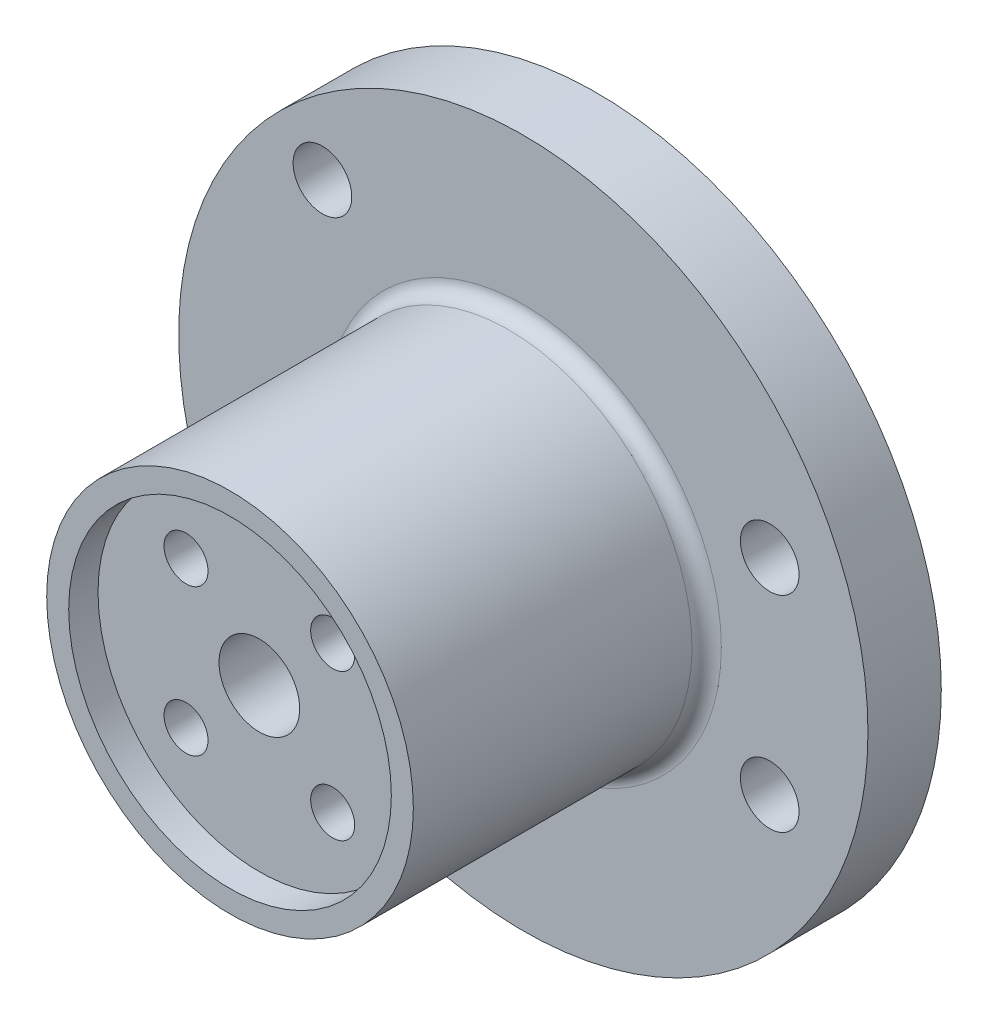
from build123d import *

# Parameters (mm, degrees)
SKETCH_1_R          = 23.5
EXTRUDE_1_DEPTH     = 5
SKETCH_2_R          = 2
CUT_EXTRUDE_1_DEPTH = 59.495923488
SKETCH_3_R          = 12.5
EXTRUDE_3_DEPTH     = 25
SKETCH_4_R          = 4
SKETCH_4_R_2        = 1.5
CUT_EXTRUDE_2_DEPTH = 64.41745079
SKETCH_5_R          = 11
CUT_EXTRUDE_3_DEPTH = 2
CUT_EXTRUDE_START   = -20
SKETCH_6_R          = 2.75
SKETCH_6_R_2        = 1.5
CUT_EXTRUDE_5_DEPTH = 20
EXTRUDE_START       = -23
SKETCH_7_R          = 4
SKETCH_7_R_2        = 2.75
EXTRUDE_4_DEPTH     = 23
FILLET_1_R          = 1


with BuildPart() as part:
    # 草图1 → 凸台-拉伸1 (new body)
    with BuildSketch(Plane.XY):
        with Locations((0, -29.834070393)):
            Circle(SKETCH_1_R)
    extrude(amount=EXTRUDE_1_DEPTH)

    # 草图2 → 切除-拉伸1 (cut, through all)
    with BuildSketch(Plane(origin=(0, 0, 0), x_dir=(-1, 0, 0), z_dir=(0, 0, -1))):
        with Locations((13.699273048, -15.834070393)):
            Circle(SKETCH_2_R)
        with Locations((13.699273048, -43.834070393)):
            Circle(SKETCH_2_R)
        with Locations((-16.800726952, -22.884070393)):
            Circle(SKETCH_2_R)
        with Locations((-16.800726952, -36.884070393)):
            Circle(SKETCH_2_R)
        with Locations((13.699273048, -29.834070393)):
            Circle(SKETCH_2_R)
    extrude(amount=-CUT_EXTRUDE_1_DEPTH, mode=Mode.SUBTRACT)

    # 草图3 → 凸台-拉伸3 (add)
    with BuildSketch(Plane(origin=(0, 0, 0), x_dir=(-1, 0, 0), z_dir=(0, 0, -1))):
        with Locations((0, -29.834070393)):
            Circle(SKETCH_3_R)
    extrude(amount=-EXTRUDE_3_DEPTH)

    # 草图4 → 切除-拉伸2 (cut, through all)
    with BuildSketch(Plane.XY.offset(25)):
        with BuildLine():
            ThreePointArc((-3.5, -24.834070393), (-6.060660172, -23.773410221), (-5, -26.334070393))
            Line((-5, -26.334070393), (-5, -24.834070393))
            Line((-5, -24.834070393), (-3.5, -24.834070393))
        make_face()
        with BuildLine():
            Line((-5, -24.834070393), (-5, -26.334070393))
            ThreePointArc((-5, -26.334070393), (-3.939339828, -25.894730565), (-3.5, -24.834070393))
            Line((-3.5, -24.834070393), (-5, -24.834070393))
        make_face()
        with BuildLine():
            ThreePointArc((3.5, -24.834070393), (3.939339828, -25.894730565), (5, -26.334070393))
            Line((5, -26.334070393), (5, -24.834070393))
            Line((5, -24.834070393), (3.5, -24.834070393))
        make_face()
        with BuildLine():
            Line((5, -24.834070393), (5, -26.334070393))
            ThreePointArc((5, -26.334070393), (6.060660172, -25.894730565), (6.5, -24.834070393))
            ThreePointArc((6.5, -24.834070393), (5, -23.334070393), (3.5, -24.834070393))
            Line((3.5, -24.834070393), (5, -24.834070393))
        make_face()
        with BuildLine():
            ThreePointArc((5, -33.334070393), (3.939339828, -33.773410221), (3.5, -34.834070393))
            Line((3.5, -34.834070393), (5, -34.834070393))
            Line((5, -34.834070393), (5, -33.334070393))
        make_face()
        with BuildLine():
            Line((5, -34.834070393), (3.5, -34.834070393))
            ThreePointArc((3.5, -34.834070393), (5, -36.334070393), (6.5, -34.834070393))
            ThreePointArc((6.5, -34.834070393), (6.060660172, -33.773410221), (5, -33.334070393))
            Line((5, -33.334070393), (5, -34.834070393))
        make_face()
        with Locations((0, -29.834070393)):
            Circle(SKETCH_4_R)
        with Locations((-5, -34.834070393)):
            Circle(SKETCH_4_R_2)
    extrude(amount=-CUT_EXTRUDE_2_DEPTH, mode=Mode.SUBTRACT)

    # 草图5 → 切除-拉伸3 (cut)
    with BuildSketch(Plane.XY.offset(25)):
        with Locations((0, -29.834070393)):
            Circle(SKETCH_5_R)
    extrude(amount=-CUT_EXTRUDE_3_DEPTH, mode=Mode.SUBTRACT)

    # 草图6 → 切除-拉伸5 (cut)
    # profile 1 of 4: a face of its own
    with BuildSketch(Plane(origin=(0, 0, 0), x_dir=(-1, 0, 0), z_dir=(0, 0, -1)).offset(CUT_EXTRUDE_START)):
        with Locations((-5, -24.834070393)):
            Circle(SKETCH_6_R)
        with Locations(Location((-5, -24.834070393, 0), (0, 0, 180))):
            Circle(SKETCH_6_R_2, mode=Mode.SUBTRACT)
    # profile 2 of 4: a face of its own
    with BuildSketch(Plane(origin=(0, 0, 0), x_dir=(-1, 0, 0), z_dir=(0, 0, -1)).offset(CUT_EXTRUDE_START)):
        with Locations((5, -24.834070393)):
            Circle(SKETCH_6_R)
        with Locations(Location((5, -24.834070393, 0), (0, 0, 180))):
            Circle(SKETCH_6_R_2, mode=Mode.SUBTRACT)
    # profile 3 of 4: a face of its own
    with BuildSketch(Plane(origin=(0, 0, 0), x_dir=(-1, 0, 0), z_dir=(0, 0, -1)).offset(CUT_EXTRUDE_START)):
        with Locations((-5, -34.834070393)):
            Circle(SKETCH_6_R)
        with Locations(Location((-5, -34.834070393, 0), (0, 0, 180))):
            Circle(SKETCH_6_R_2, mode=Mode.SUBTRACT)
    # profile 4 of 4: a face of its own
    with BuildSketch(Plane(origin=(0, 0, 0), x_dir=(-1, 0, 0), z_dir=(0, 0, -1)).offset(CUT_EXTRUDE_START)):
        with Locations((5, -34.834070393)):
            Circle(SKETCH_6_R)
        with Locations(Location((5, -34.834070393, 0), (0, 0, 180))):
            Circle(SKETCH_6_R_2, mode=Mode.SUBTRACT)
    extrude(amount=CUT_EXTRUDE_5_DEPTH, mode=Mode.SUBTRACT)

    # 草图7 → 凸台-拉伸4 (add)
    with BuildSketch(Plane(origin=(0, 0, 0), x_dir=(-1, 0, 0), z_dir=(0, 0, -1)).offset(EXTRUDE_START)):
        with Locations((0, -29.834070393)):
            Circle(SKETCH_7_R)
        with Locations((0, -29.834070393)):
            Circle(SKETCH_7_R_2, mode=Mode.SUBTRACT)
    extrude(amount=EXTRUDE_4_DEPTH)

    # 圆角1
    fillet_1_edges = [part.edges().sort_by_distance(p)[0] for p in [
        (12.5, -29.834070393, 5),
    ]]
    fillet(fillet_1_edges, radius=FILLET_1_R)


solid = part.part
